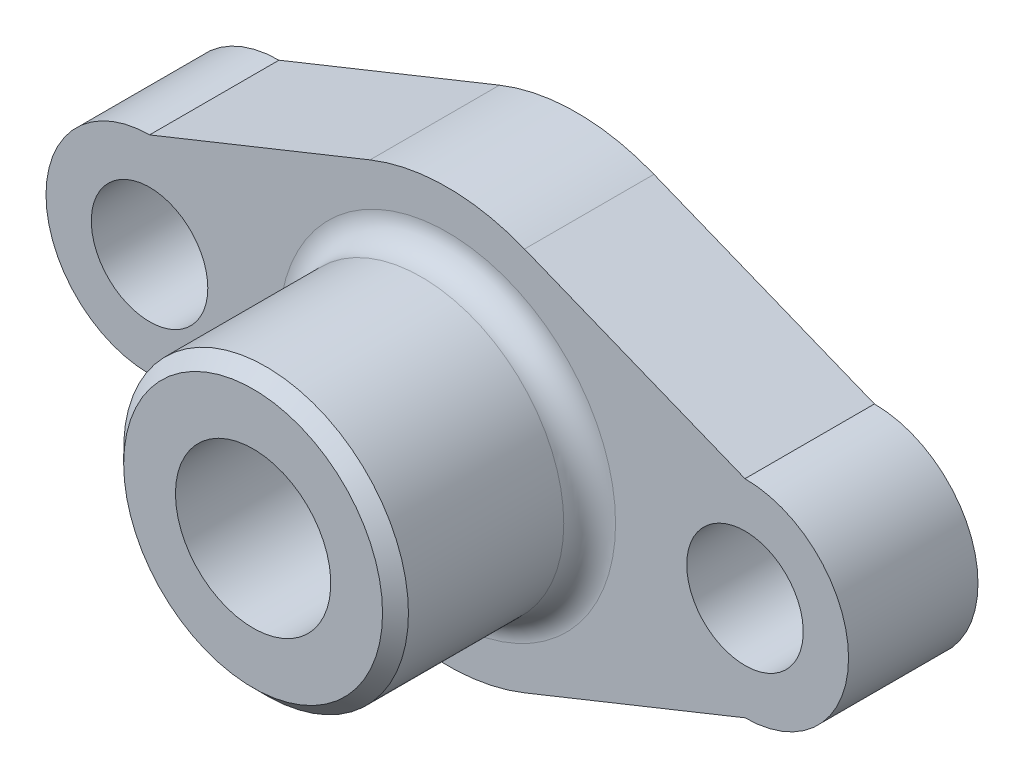
from build123d import *

# Parameters (mm, degrees)
SKETCH_1_R      = 4.5
EXTRUDE_1_DEPTH = 10
SKETCH_4_R      = 11
EXTRUDE_2_DEPTH = 25
FILLET_1_R      = 2
CHAMFER_1_SIZE  = 1


with BuildPart() as part:
    # Эскиз1 → Бобышка-Вытянуть1 (new body)
    with BuildSketch(Plane.XY):
        with BuildLine():
            Line((-23, 8), (-5.966665012, 14.845838091))
            ThreePointArc((-5.966665012, 14.845838091), (0, 16), (5.966665012, 14.845838091))
            Line((5.966665012, 14.845838091), (23, 8))
            ThreePointArc((23, 8), (31, 0), (23, -8))
            Line((23, -8), (5.966665012, -14.845838091))
            ThreePointArc((5.966665012, -14.845838091), (0, -16), (-5.966665012, -14.845838091))
            Line((-5.966665012, -14.845838091), (-23, -8))
            ThreePointArc((-23, -8), (-31, 0), (-23, 8))
        make_face()
        with Locations((-23, 0)):
            Circle(SKETCH_1_R, mode=Mode.SUBTRACT)
        with Locations(Location((23, 0, 0), (0, 0, 180))):
            Circle(SKETCH_1_R, mode=Mode.SUBTRACT)
    extrude(amount=EXTRUDE_1_DEPTH)

    # Эскиз4 → Бобышка-Вытянуть2 (add)
    with BuildSketch(Plane.XY):
        Circle(SKETCH_4_R)
    extrude(amount=EXTRUDE_2_DEPTH)

    # Эскиз5 → Вырез-Повернуть1 (revolve, cut)
    with BuildSketch(Plane(origin=(0, 0, 0), x_dir=(1, 0, 0), z_dir=(0, 1, 0))):
        with BuildLine():
            Line((0, 0), (-10, 0))
            Line((-10, 0), (-8.122654092, -13.141421356))
            ThreePointArc((-8.122654092, -13.141421356), (-7.78790634, -13.755453955), (-7.132704598, -14))
            Line((-7.132704598, -14), (-6, -14))
            Line((-6, -14), (-6, -25))
            Line((-6, -25), (0, -25))
            Line((0, -25), (0, 0))
        make_face()
    revolve(axis=Axis((0, 0, -38.345280775), (0, 0, 1)), mode=Mode.SUBTRACT)

    # Скругление1
    fillet_1_edges = [part.edges().sort_by_distance(p)[0] for p in [
        (-11, 0, 10),
    ]]
    fillet(fillet_1_edges, radius=FILLET_1_R)

    # Фаска1
    chamfer_1_edges = [part.edges().sort_by_distance(p)[0] for p in [
        (-11, 0, 25),
    ]]
    chamfer(chamfer_1_edges, length=CHAMFER_1_SIZE)


solid = part.part
